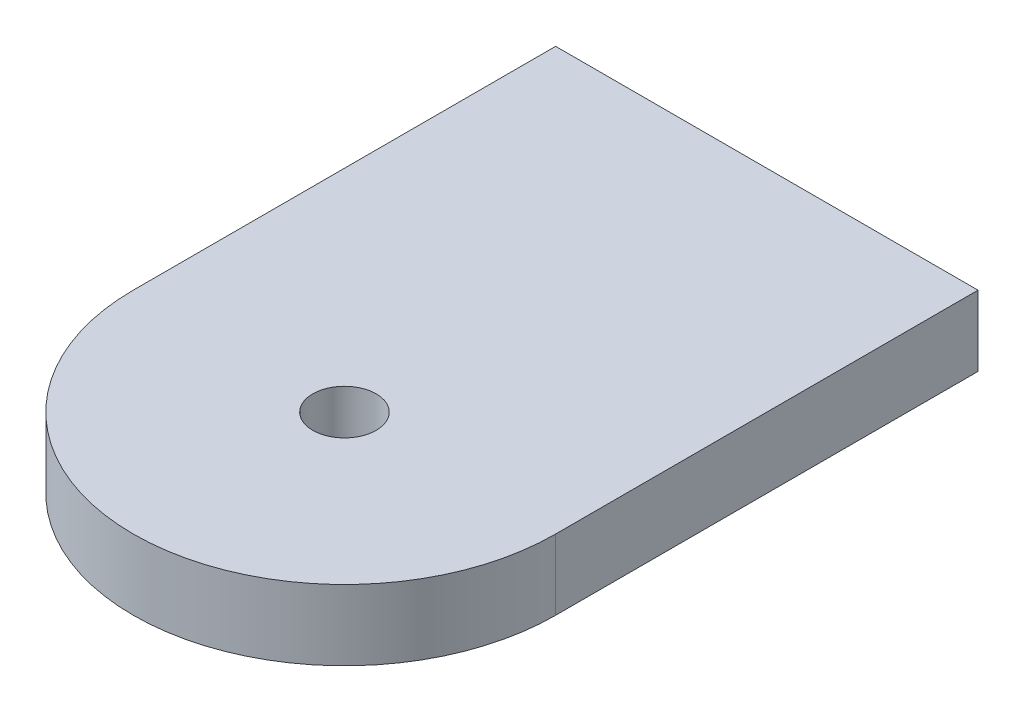
from build123d import *

# Parameters (mm, degrees)
SKETCH1_R           = 0.45
BOSS_EXTRUDE1_DEPTH = 1


with BuildPart() as part:
    # Sketch1 → Boss-Extrude1 (new body)
    with BuildSketch(Plane(origin=(0, 0, 0), x_dir=(1, 0, 0), z_dir=(0, 1, 0))):
        with BuildLine():
            Line((0, 0), (6, 0))
            Line((6, 0), (6, -6))
            ThreePointArc((6, -6), (3, -9), (0, -6))
            Line((0, -6), (0, 0))
        make_face()
        with Locations(Location((3, -6, 0), (0, 0, 270))):
            Circle(SKETCH1_R, mode=Mode.SUBTRACT)
    extrude(amount=BOSS_EXTRUDE1_DEPTH)


solid = part.part
